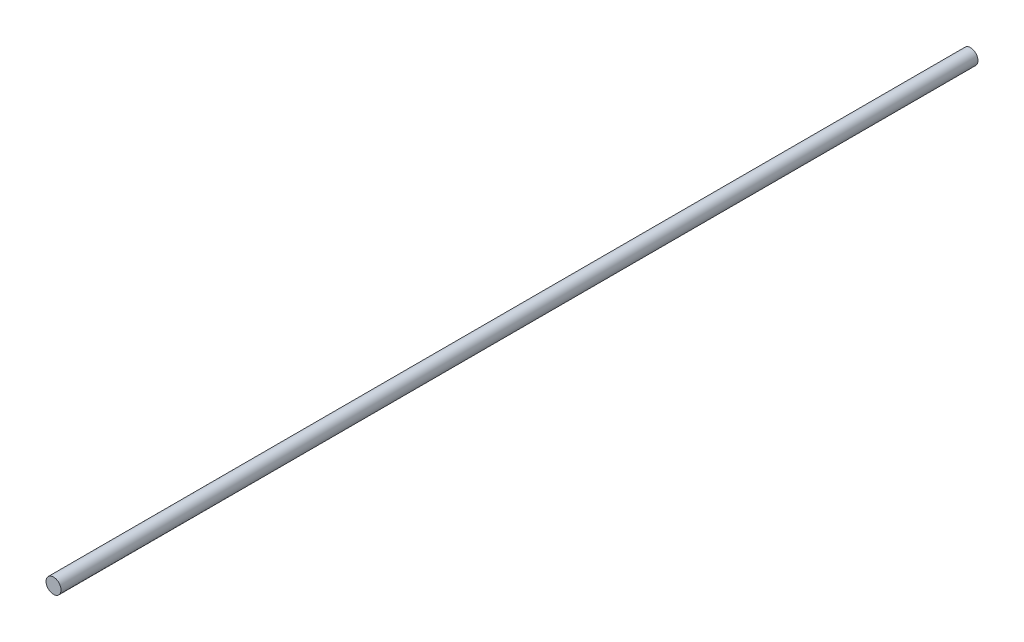
from build123d import *

# Parameters (mm, degrees)
ESQUISSE1_R        = 5
BOSS_EXTRU_1_DEPTH = 610


with BuildPart() as part:
    # Esquisse1 → Boss.-Extru.1 (new body)
    with BuildSketch(Plane.XY):
        Circle(ESQUISSE1_R)
    extrude(amount=BOSS_EXTRU_1_DEPTH)


solid = part.part
